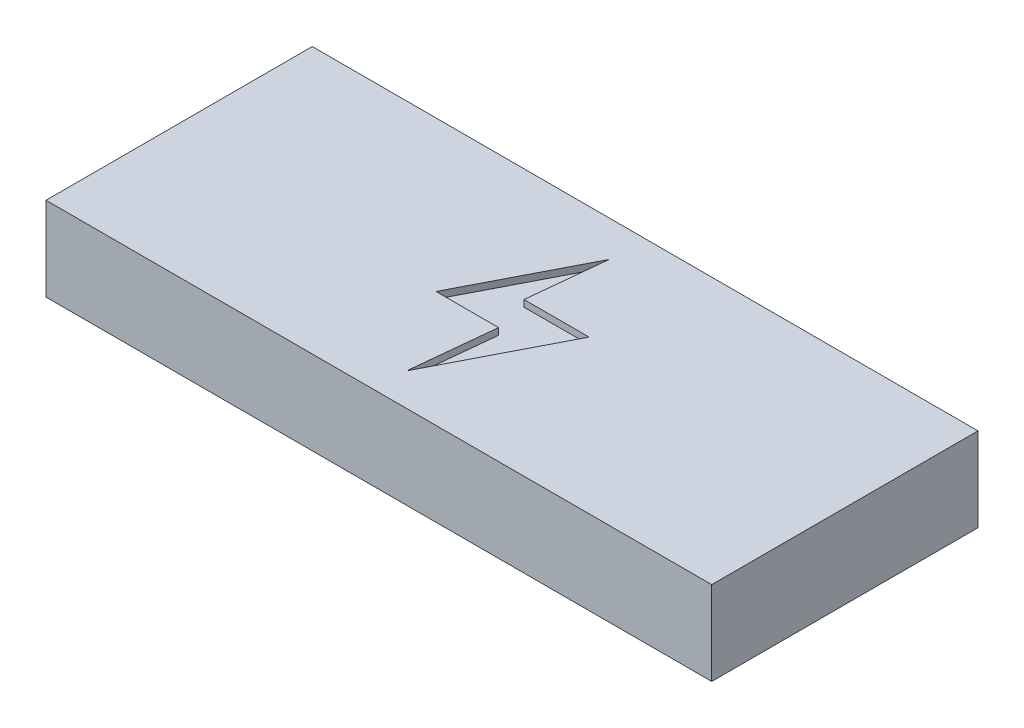
from build123d import *

# Parameters (mm, degrees)
SKETCH1_W           = 50
SKETCH1_H           = 20
BOSS_EXTRUDE1_DEPTH = 6.3
CUT_EXTRUDE1_DEPTH  = 0.5


with BuildPart() as part:
    # Sketch1 → Boss-Extrude1 (new body)
    with BuildSketch(Plane(origin=(0, 0, 0), x_dir=(1, 0, 0), z_dir=(0, 1, 0))):
        Rectangle(SKETCH1_W, SKETCH1_H)
    extrude(amount=BOSS_EXTRUDE1_DEPTH)

    # Sketch2 → Cut-Extrude1 (cut)
    with BuildSketch(Plane(origin=(0, 6.3, 0), x_dir=(1, 0, 0), z_dir=(0, 1, 0))):
        Polygon((0, 7.306031024), (-4.42027104, -1.284669112), (0.278202797, -1.284669112), (-0.362091911, -7.550266361), (4.293022443, 1.49684662), (-0.593652908, 1.49684662), align=None)
    extrude(amount=-CUT_EXTRUDE1_DEPTH, mode=Mode.SUBTRACT)


solid = part.part
